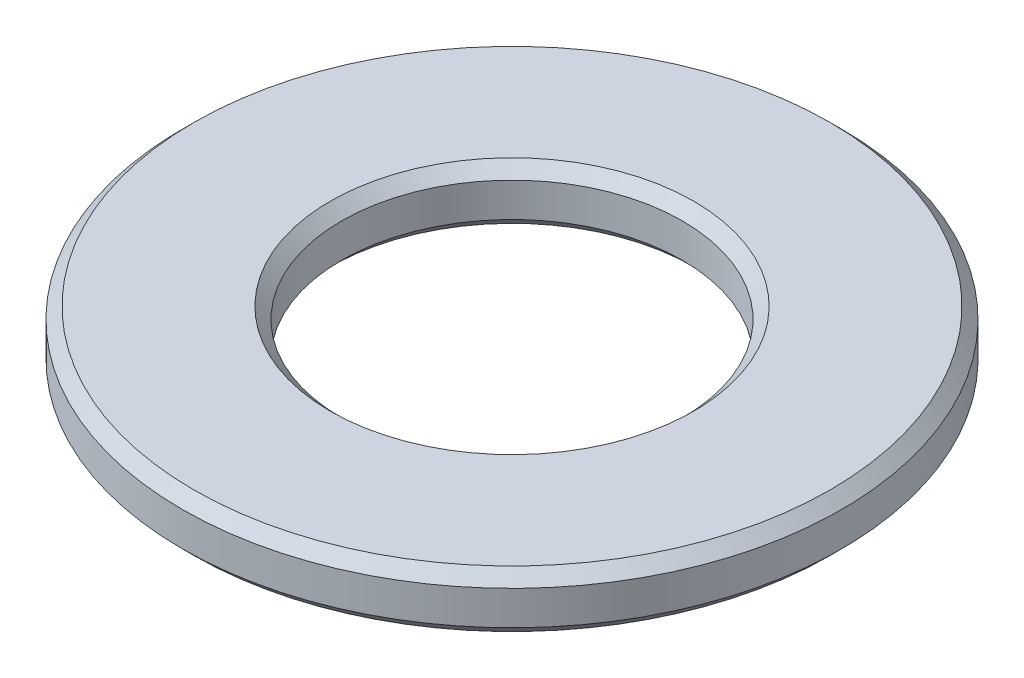
from build123d import *

# Parameters (mm, degrees)
SKIZZE1_R                       = 2.9
SKIZZE1_R_2                     = 1.5
AUFSATZ_LINEAR_AUSTRAGEN1_DEPTH = 0.5
FASE1_SIZE                      = 0.1


with BuildPart() as part:
    # Skizze1 → Aufsatz-Linear austragen1 (new body)
    with BuildSketch(Plane(origin=(0, 0, 0), x_dir=(1, 0, 0), z_dir=(0, 1, 0))):
        Circle(SKIZZE1_R)
        Circle(SKIZZE1_R_2, mode=Mode.SUBTRACT)
    extrude(amount=AUFSATZ_LINEAR_AUSTRAGEN1_DEPTH)

    # Fase1
    fase1_edges = [part.edges().sort_by_distance(p)[0] for p in [
        (-2.9, 0, 0),
        (-1.5, 0, 0),
        (-1.5, 0.5, 0),
        (-2.9, 0.5, 0),
    ]]
    chamfer(fase1_edges, length=FASE1_SIZE)


solid = part.part
